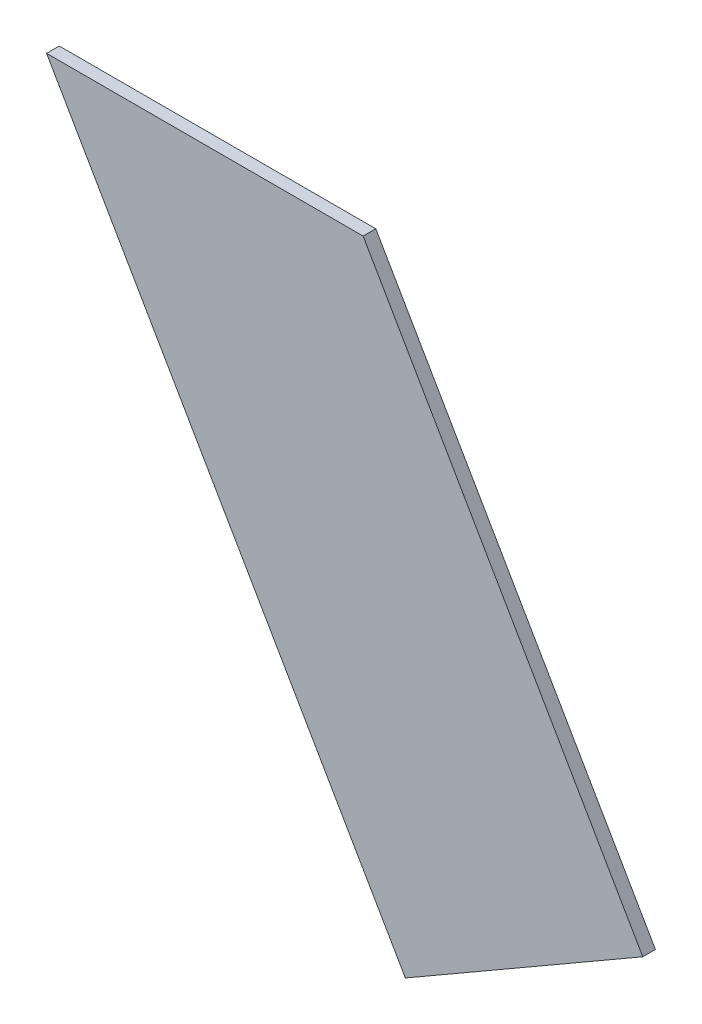
from build123d import *

# Parameters (mm, degrees)
BOSS_EXTRUDE1_DEPTH = 3


with BuildPart() as part:
    # Sketch1 → Boss-Extrude1 (new body)
    with BuildSketch(Plane.XY):
        Polygon((-66.615131935, 32.828435112), (8.384868065, 32.828435112), (74.634868065, -81.919930889), (18.384868065, -114.395883531), (-17.375131935, -52.457746653), align=None)
    extrude(amount=BOSS_EXTRUDE1_DEPTH)


solid = part.part
